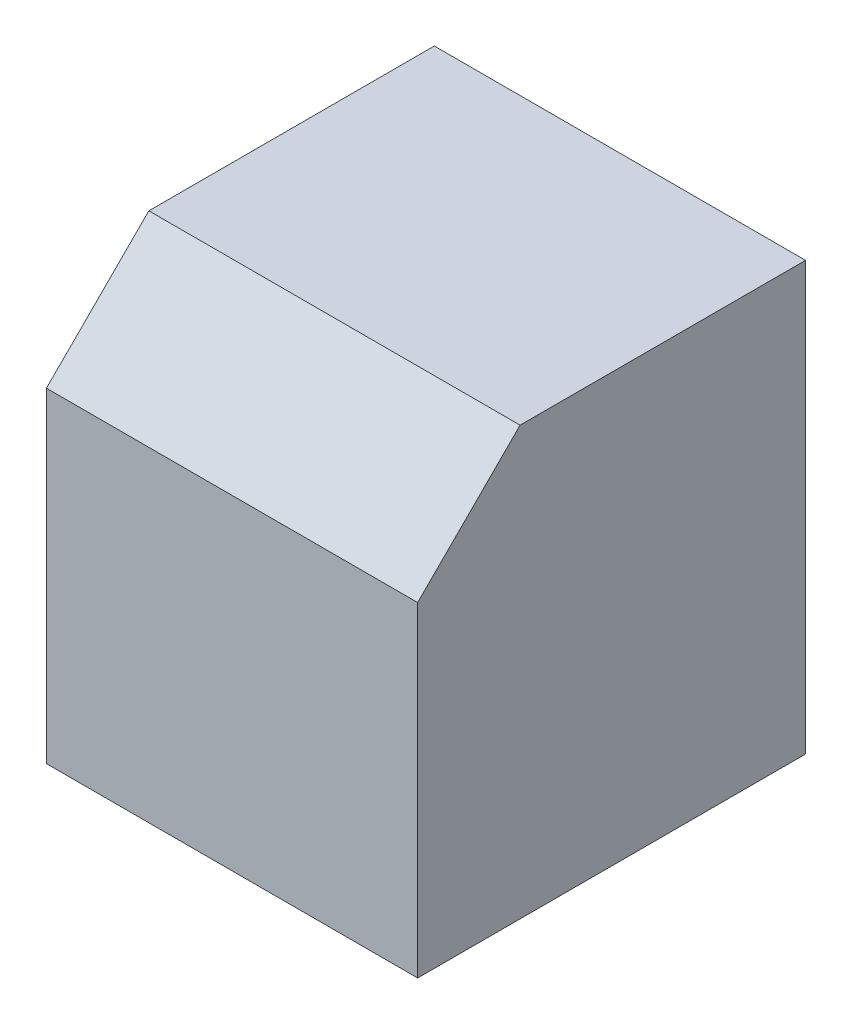
from build123d import *

# Parameters (mm, degrees)
SKETCH1_W           = 29
SKETCH1_H           = 33.4
BOSS_EXTRUDE2_DEPTH = 30.3
CUT_EXTRUDE1_DEPTH  = 54.615762608


with BuildPart() as part:
    # Sketch1 → Boss-Extrude2 (new body)
    with BuildSketch(Plane.XY):
        with Locations((14.5, 16.7)):
            Rectangle(SKETCH1_W, SKETCH1_H)
    extrude(amount=BOSS_EXTRUDE2_DEPTH)

    # Sketch2 → Cut-Extrude1 (cut, through all)
    with BuildSketch(Plane.ZY):
        Polygon((22.3, 33.4), (30.3, 25.4), (30.3, 33.4), align=None)
    extrude(amount=-CUT_EXTRUDE1_DEPTH, mode=Mode.SUBTRACT)


solid = part.part
